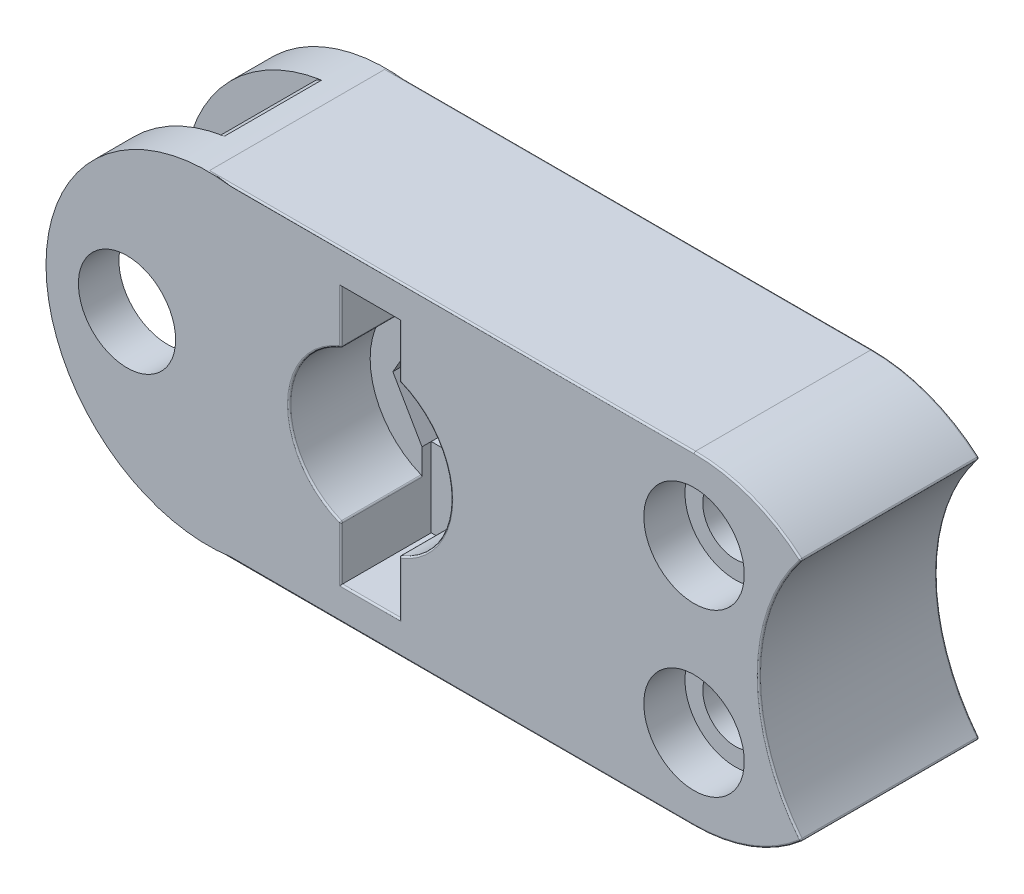
from build123d import *
from build123d.topology import SkipClean

# Parameters (mm, degrees)
SKETCH_1_R                                   = 40
EXTRUDE_1_DEPTH                              = 110
SKETCH_2_R                                   = 3
CUT_EXTRUDE_2_DEPTH                          = 150
SKETCH_3_R                                   = 50
CUT_EXTRUDE_3_DEPTH                          = 50
CUT_EXTRUDE_4_DEPTH                          = 10
SKETCH_5_W                                   = 36
SKETCH_5_H                                   = 160
CUT_EXTRUDE_7_DEPTH                          = 122
CUT_EXTRUDE_8_DEPTH                          = 10
SKETCH_7_R                                   = 3
CUT_EXTRUDE_9_DEPTH                          = 10
CUT_EXTRUDE_12_DEPTH                         = 200
SKETCH_9_R                                   = 31
SKETCH_9_R_2                                 = 12.5
CUT_EXTRUDE_13_DEPTH                         = 25.4
MIRROR_3_AT_THE_SECOND_PLANE_COPY_1_DEPTH    = 200
MIRROR_3_AT_THE_SECOND_PLANE_COPY_2_SKET_R   = 31
MIRROR_3_AT_THE_SECOND_PLANE_COPY_2_SKET_R_2 = 12.5
MIRROR_3_AT_THE_SECOND_PLANE_COPY_2_DEPTH    = 25.4
EXTRUDE_START                                = 4.3
EXTRUDE_2_DEPTH                              = 4.3
SKETCH_11_W                                  = 36
SKETCH_11_H                                  = 48.823085464
SKETCH_11_R                                  = 3
EXTRUDE_3_DEPTH                              = 4.3
CUT_EXTRUDE_START                            = -200
CUT_EXTRUDE_14_DEPTH                         = 200
SKETCH_13_R                                  = 20
CUT_EXTRUDE_15_DEPTH                         = 200
CUT_EXTRUDE_16_DEPTH                         = 200
FILLET_1_R                                   = 1
FILLET_2_R                                   = 1
EXTRUDE_START_2                              = -110
SKETCH_18_R                                  = 40
EXTRUDE_6_DEPTH                              = 110
CUT_EXTRUDE_START_2                          = -110
CUT_EXTRUDE_20_DEPTH                         = 110
EXTRUDE_START_3                              = -25
EXTRUDE_7_DEPTH                              = 25
CUT_EXTRUDE_21_DEPTH                         = 25


with BuildPart() as part:
    # 草图1 → 凸台-拉伸1 (new body)
    with BuildSketch(Plane.XY):
        with BuildLine():
            Line((-100.092421442, 100), (199.907578558, 100))
            ThreePointArc((199.907578558, 100), (299.907578558, 0), (199.907578558, -100))
            Line((199.907578558, -100), (-100.092421442, -100))
            ThreePointArc((-100.092421442, -100), (-200.092421442, 0), (-100.092421442, 100))
        make_face()
        with Locations((-110.092421442, 0)):
            Circle(SKETCH_1_R, mode=Mode.SUBTRACT)
    extrude(amount=EXTRUDE_1_DEPTH)

    # 草图2 → 切除-拉伸2 (cut)
    with BuildSketch(Plane(origin=(-100, 0, 0), x_dir=(0, 0, -1), z_dir=(1, 0, 0))):
        with Locations((-95, 0)):
            Circle(SKETCH_2_R)
        with Locations((-75, 0)):
            Circle(SKETCH_2_R)
        with Locations((-55, 0)):
            Circle(SKETCH_2_R)
    extrude(amount=-CUT_EXTRUDE_2_DEPTH, mode=Mode.SUBTRACT)

    # 草图3 → 切除-拉伸3 (cut)
    with BuildSketch(Plane.XY.offset(110)):
        Circle(SKETCH_3_R)
    extrude(amount=-CUT_EXTRUDE_3_DEPTH, mode=Mode.SUBTRACT)

    # 草图4 → 切除-拉伸4 (cut)
    with BuildSketch(Plane.XY.offset(60)):
        Polygon((36, 0), (18, 31.176914536), (-18, 31.176914536), (-36, 0), (-18, -31.176914536), (18, -31.176914536), align=None)
    extrude(amount=-CUT_EXTRUDE_4_DEPTH, mode=Mode.SUBTRACT)

    # 草图5 → 切除-拉伸7 (cut)
    with BuildSketch(Plane.XY.offset(50)):
        Rectangle(SKETCH_5_W, SKETCH_5_H)
    extrude(amount=CUT_EXTRUDE_7_DEPTH, mode=Mode.SUBTRACT)

    # 草图6 → 切除-拉伸8 (cut)
    with BuildSketch(Plane.XY.offset(50)):
        Polygon((36, 0), (18, 31.176914536), (-18, 31.176914536), (-36, 0), (-18, -31.176914536), (18, -31.176914536), align=None)
    extrude(amount=-CUT_EXTRUDE_8_DEPTH, mode=Mode.SUBTRACT)

    # 草图7 → 切除-拉伸9 (cut)
    with BuildSketch(Plane.XY.offset(50)):
        with Locations((0, 62)):
            Circle(SKETCH_7_R)
    cut_extrude_9 = extrude(amount=-CUT_EXTRUDE_9_DEPTH, mode=Mode.SUBTRACT)

    # 镜向1: 切除-拉伸9 across plane
    add(cut_extrude_9.mirror(Plane.ZX), mode=Mode.SUBTRACT)

    # 草图8 → 切除-拉伸12 (cut)
    with BuildSketch(Plane.XY.offset(110)):
        with BuildLine():
            ThreePointArc((212.407578558, 50), (208.746413323, 58.838834765), (199.907578558, 62.5))
            Line((199.907578558, 62.5), (199.907578558, 37.5))
            ThreePointArc((199.907578558, 37.5), (208.746413323, 41.161165235), (212.407578558, 50))
        make_face()
        with BuildLine():
            Line((199.907578558, 37.5), (199.907578558, 62.5))
            ThreePointArc((199.907578558, 62.5), (187.407578558, 50), (199.907578558, 37.5))
        make_face()
    cut_extrude_12 = extrude(amount=-CUT_EXTRUDE_12_DEPTH, mode=Mode.SUBTRACT)

    # 草图9 → 切除-拉伸13 (cut)
    with BuildSketch(Plane.XY.offset(110)):
        with Locations((199.907578558, 50)):
            Circle(SKETCH_9_R)
        with Locations((199.907578558, 50)):
            Circle(SKETCH_9_R_2, mode=Mode.SUBTRACT)
    cut_extrude_13 = extrude(amount=-CUT_EXTRUDE_13_DEPTH, mode=Mode.SUBTRACT)

    # 镜向3: 切除-拉伸12, 切除-拉伸13 across plane
    add(cut_extrude_12.mirror(Plane.ZX), mode=Mode.SUBTRACT)
    add(cut_extrude_13.mirror(Plane.ZX), mode=Mode.SUBTRACT)

    # 镜向3 at the second plane: 切除-拉伸12, 切除-拉伸13 across plane
    add(cut_extrude_12.mirror(Plane.XY.offset(55)), mode=Mode.SUBTRACT)
    add(cut_extrude_13.mirror(Plane.XY.offset(55)), mode=Mode.SUBTRACT)

    # 镜向3 at the second plane copy 1 sket → 镜向3 at the second plane copy 1 (cut)
    with BuildSketch(Plane(origin=(0, 0, 0), x_dir=(1, 0, 0), z_dir=(0, 0, -1))):
        with BuildLine():
            ThreePointArc((212.407578558, 50), (208.746413323, 58.838834765), (199.907578558, 62.5))
            Line((199.907578558, 62.5), (199.907578558, 37.5))
            ThreePointArc((199.907578558, 37.5), (208.746413323, 41.161165235), (212.407578558, 50))
        make_face()
        with BuildLine():
            Line((199.907578558, 37.5), (199.907578558, 62.5))
            ThreePointArc((199.907578558, 62.5), (187.407578558, 50), (199.907578558, 37.5))
        make_face()
    extrude(amount=-MIRROR_3_AT_THE_SECOND_PLANE_COPY_1_DEPTH, mode=Mode.SUBTRACT)

    # 镜向3 at the second plane copy 2 sket → 镜向3 at the second plane copy 2 (cut)
    with BuildSketch(Plane(origin=(0, 0, 0), x_dir=(1, 0, 0), z_dir=(0, 0, -1))):
        with Locations((199.907578558, 50)):
            Circle(MIRROR_3_AT_THE_SECOND_PLANE_COPY_2_SKET_R)
        with Locations((199.907578558, 50)):
            Circle(MIRROR_3_AT_THE_SECOND_PLANE_COPY_2_SKET_R_2, mode=Mode.SUBTRACT)
    extrude(amount=-MIRROR_3_AT_THE_SECOND_PLANE_COPY_2_DEPTH, mode=Mode.SUBTRACT)

    # 草图10 → 凸台-拉伸2 (add)
    with BuildSketch(Plane.XY.offset(40).offset(EXTRUDE_START)):
        with BuildLine():
            ThreePointArc((18, 31.176914536), (31.176914536, 18), (36, 0))
            ThreePointArc((36, 0), (31.176914536, -18), (18, -31.176914536))
            Line((18, -31.176914536), (18, -46.647615159))
            ThreePointArc((18, -46.647615159), (41.231056256, -28.284271247), (50, 0))
            ThreePointArc((50, 0), (41.231056256, 28.284271247), (18, 46.647615159))
            Line((18, 46.647615159), (18, 31.176914536))
        make_face()
        with BuildLine():
            ThreePointArc((-36, 0), (-31.176914536, 18), (-18, 31.176914536))
            Line((-18, 31.176914536), (-18, 46.647615159))
            ThreePointArc((-18, 46.647615159), (-50, 0), (-18, -46.647615159))
            Line((-18, -46.647615159), (-18, -31.176914536))
            ThreePointArc((-18, -31.176914536), (-31.176914536, -18), (-36, 0))
        make_face()
        with BuildLine():
            Line((18, 31.176914536), (36, 0))
            ThreePointArc((36, 0), (31.176914536, 18), (18, 31.176914536))
        make_face()
        with BuildLine():
            ThreePointArc((18, -31.176914536), (31.176914536, -18), (36, 0))
            Line((36, 0), (18, -31.176914536))
        make_face()
        with BuildLine():
            ThreePointArc((-36, 0), (-31.176914536, -18), (-18, -31.176914536))
            Line((-18, -31.176914536), (-36, 0))
        make_face()
        with BuildLine():
            Line((-36, 0), (-18, 31.176914536))
            ThreePointArc((-18, 31.176914536), (-31.176914536, 18), (-36, 0))
        make_face()
    extrude(amount=-EXTRUDE_2_DEPTH)

    # 草图11 → 凸台-拉伸3 (add)
    with BuildSketch(Plane.XY.offset(50).offset(EXTRUDE_START)):
        with Locations((0, 55.588457268)):
            Rectangle(SKETCH_11_W, SKETCH_11_H)
        with Locations((0, 62)):
            Circle(SKETCH_11_R, mode=Mode.SUBTRACT)
    extrude_3 = extrude(amount=-EXTRUDE_3_DEPTH)

    # 镜向4: 凸台-拉伸3 across plane
    add(extrude_3.mirror(Plane.ZX))

    # 草图12 → 切除-拉伸14 (cut)
    with BuildSketch(Plane.XY.offset(110).offset(CUT_EXTRUDE_START)):
        with BuildLine():
            ThreePointArc((299.907578558, 0), (291.080491202, 41.079191813), (266.157578558, 74.906191333))
            ThreePointArc((266.157578558, 74.906191333), (246.660062029, 39.686269666), (239.907578558, 0))
            Line((239.907578558, 0), (299.907578558, 0))
        make_face()
        with BuildLine():
            ThreePointArc((479.907578558, 0), (399.593848224, 113.247516529), (266.157578558, 74.906191333))
            ThreePointArc((266.157578558, 74.906191333), (291.080491202, 41.079191813), (299.907578558, 0))
            ThreePointArc((299.907578558, 0), (291.080491202, -41.079191813), (266.157578558, -74.906191333))
            ThreePointArc((266.157578558, -74.906191333), (399.593848224, -113.247516529), (479.907578558, 0))
        make_face()
        with BuildLine():
            Line((299.907578558, 0), (239.907578558, 0))
            ThreePointArc((239.907578558, 0), (246.660062029, -39.686269666), (266.157578558, -74.906191333))
            ThreePointArc((266.157578558, -74.906191333), (291.080491202, -41.079191813), (299.907578558, 0))
        make_face()
    extrude(amount=CUT_EXTRUDE_14_DEPTH, mode=Mode.SUBTRACT)

    # 草图13 → 切除-拉伸15 (cut)
    with BuildSketch(Plane.XY.offset(84.6)):
        with Locations((199.907578558, 50)):
            Circle(SKETCH_13_R)
    cut_extrude_15 = extrude(amount=-CUT_EXTRUDE_15_DEPTH, mode=Mode.SUBTRACT)

    # 镜向5: 切除-拉伸15 across plane
    add(cut_extrude_15.mirror(Plane.ZX), mode=Mode.SUBTRACT)

    # 草图14 → 切除-拉伸16 (cut)
    with BuildSketch(Plane.XY.offset(110).offset(CUT_EXTRUDE_START)):
        with BuildLine():
            ThreePointArc((-114.938685096, -98.891801761), (-178.67776032, 0), (-114.938685096, 98.891801761))
            ThreePointArc((-114.938685096, 98.891801761), (-200.092421442, 0), (-114.938685096, -98.891801761))
        make_face()
    extrude(amount=CUT_EXTRUDE_16_DEPTH, mode=Mode.SUBTRACT)

    # 圆角1
    fillet_1_edges = [part.edges().sort_by_distance(p)[0] for p in [
        (235.329188253, -93.516359888, 110),
        (49.907578558, 100, 110),
        (235.329188253, 93.516359888, 0),
        (235.329188253, 93.516359888, 110),
        (266.157578558, 74.906191333, 55),
        (266.157578558, -74.906191333, 55),
        (239.907578558, 0, 0),
        (239.907578558, 0, 110),
        (-107.536204885, -99.722565591, 0),
        (-107.536204885, -99.722565591, 110),
        (-107.536204885, 99.722565591, 110),
        (49.907578558, 100, 0),
        (235.329188253, -93.516359888, 0),
        (49.907578558, -100, 0),
        (-107.536204885, 99.722565591, 0),
        (49.907578558, -100, 110),
    ]]
    fillet(fillet_1_edges, radius=FILLET_1_R)

    # 圆角2
    fillet_2_edges = [part.edges().sort_by_distance(p)[0] for p in [
        (-50, 0, 110),
        (50, 0, 110),
        (0, -80, 110),
        (-18, 46.647615159, 85),
        (-18, -46.647615159, 85),
        (-18, -63.323807579, 110),
        (18, -46.647615159, 85),
        (18, 46.647615159, 85),
        (18, -63.323807579, 110),
        (-18, 63.323807579, 110),
        (18, 63.323807579, 110),
    ]]
    fillet(fillet_2_edges, radius=FILLET_2_R)

    # 草图18 → 凸台-拉伸6 (add)
    # profile 1 of 2: a face of its own
    with BuildSketch(Plane.XY.offset(110).offset(EXTRUDE_START_2)):
        with BuildLine():
            ThreePointArc((-54.044965251, 0), (-70.729632471, 57.779453715), (-115.646949135, 97.770428394))
            ThreePointArc((-115.646949135, 97.770428394), (-116.952657244, 97.553741336), (-118.255351762, 97.319617561))
            ThreePointArc((-118.255351762, 97.319617561), (-178.67776032, 0), (-118.255351762, -97.319617561))
            ThreePointArc((-118.255351762, -97.319617561), (-116.952657244, -97.553741336), (-115.646949135, -97.770428394))
            ThreePointArc((-115.646949135, -97.770428394), (-70.729632471, -57.779453715), (-54.044965251, 0))
        make_face()
        with Locations((-110.092421442, 0)):
            Circle(SKETCH_18_R, mode=Mode.SUBTRACT)
    # profile 2 of 2: a face of its own
    with BuildSketch(Plane.XY.offset(110).offset(EXTRUDE_START_2)):
        with Locations((-110.092421442, 0)):
            Circle(SKETCH_18_R)
    extrude(amount=EXTRUDE_6_DEPTH)

    # 草图19 → 切除-拉伸20 (cut)
    with BuildSketch(Plane.XY.offset(110).offset(CUT_EXTRUDE_START_2)):
        with BuildLine():
            Line((-100.092421442, -99), (-100.092421442, 99))
            ThreePointArc((-100.092421442, 99), (-109.212669834, 98.579009273), (-118.255351762, 97.319617561))
            ThreePointArc((-118.255351762, 97.319617561), (-178.67776032, 0), (-118.255351762, -97.319617561))
            ThreePointArc((-118.255351762, -97.319617561), (-109.212669834, -98.579009273), (-100.092421442, -99))
        make_face()
    extrude(amount=CUT_EXTRUDE_20_DEPTH, mode=Mode.SUBTRACT)

    # 草图20 → 凸台-拉伸7 (add)
    with SkipClean():  # the faces are left unmerged after this step: merging them gives an invalid solid
        with BuildSketch(Plane.XY.offset(110).offset(EXTRUDE_START_3)):
            with BuildLine():
                Line((-100.092421442, -99), (-100.092421442, 99))
                Line((-100.092421442, 99), (-85.985685462, 99))
                ThreePointArc((-85.985685462, 99), (-200.092421442, 0), (-85.985685462, -99))
                Line((-85.985685462, -99), (-100.092421442, -99))
            make_face()
        extrude_7 = extrude(amount=EXTRUDE_7_DEPTH)

    # 草图21 → 切除-拉伸21 (cut)
    with SkipClean():  # the faces are left unmerged after this step: merging them gives an invalid solid
        with BuildSketch(Plane.XY.offset(110)):
            with BuildLine():
                ThreePointArc((-180.092421442, 0), (-150.092421442, -30), (-120.092421442, 0))
                Line((-120.092421442, 0), (-180.092421442, 0))
            make_face()
            with BuildLine():
                Line((-180.092421442, 0), (-120.092421442, 0))
                ThreePointArc((-120.092421442, 0), (-150.092421442, 30), (-180.092421442, 0))
            make_face()
        cut_extrude_21 = extrude(amount=-CUT_EXTRUDE_21_DEPTH, mode=Mode.SUBTRACT)

    # 镜向7: 凸台-拉伸7, 切除-拉伸21 across plane
    with SkipClean():  # the faces are left unmerged after this step: merging them gives an invalid solid
        add(extrude_7.mirror(Plane.XY.offset(55)))
        add(cut_extrude_21.mirror(Plane.XY.offset(55)), mode=Mode.SUBTRACT)


solid = part.part
